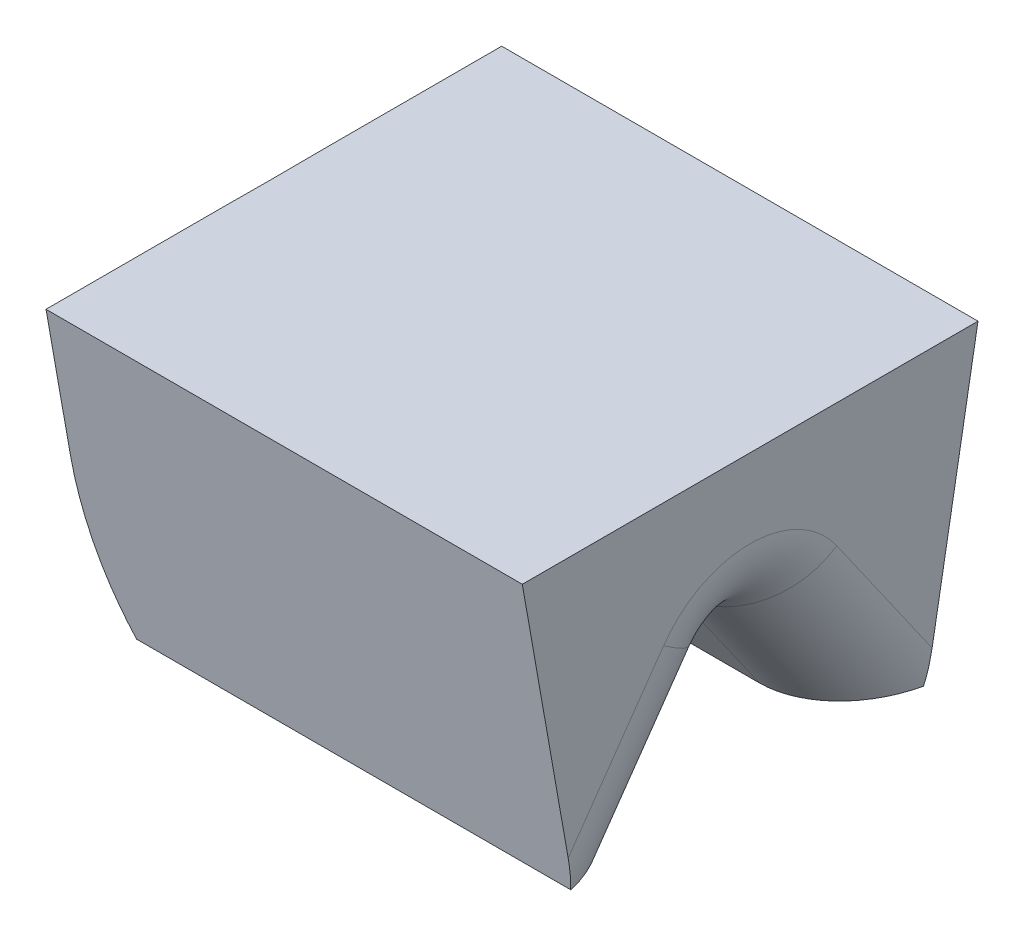
from build123d import *

# Parameters (mm, degrees)
SKETCH_TL_CUTTING_R    = 1.4986
TL_CUTTING_DEPTH       = 29.999999944
SKETCH_TDF_CUTTING_W   = 3.01719996
SKETCH_TDF_CUTTING_H   = 3.01719996
TDF_CUTTING_DEPTH      = 31.074766841
VW_VR_GRINDING_DEPTH   = 1.50859998
VW_VR_GRINDING_2_DEPTH = 1.50859998
ISA_GRINDING_DEPTH     = 1.50859998
SKETCH_PRE_FRX_BRX_W   = 1.15078002
SKETCH_PRE_FRX_BRX_H   = 0.89916
SKETCH_PRE_FRX_BRX_W_2 = 1.18077996
PRE_FRX_BRX_DEPTH      = 1.50859998
FA_BA_GRINDING_DEPTH   = 1.50859998
BR_EDM_R               = 0.24892
FR_EDM_R               = 0.12446


with BuildPart() as part:
    # sketch_TL_cutting → TL_cutting (new body)
    with BuildSketch(Plane(origin=(0, 0, 0), x_dir=(1, 0, 0), z_dir=(0, 1, 0))):
        with Locations(Location((0, 0, 0), (0, 0, 270))):
            Circle(SKETCH_TL_CUTTING_R)
    extrude(amount=TL_CUTTING_DEPTH)

    # sketch_TDF_cutting → TDF_cutting (cut, through all)
    with BuildSketch(Plane(origin=(0, 0, 0), x_dir=(1, 0, 0), z_dir=(0, 1, 0))):
        with Locations((-2.71001998, 0)):
            Rectangle(SKETCH_TDF_CUTTING_W, SKETCH_TDF_CUTTING_H)
    extrude(amount=TDF_CUTTING_DEPTH, mode=Mode.SUBTRACT)


with BuildPart() as body_2:
    # sketch_VW_VR_grinding → VW_VR_grinding (new, symmetric)
    with BuildSketch(Plane(origin=(0, 0, 0), x_dir=(0, 0, -1), z_dir=(1, 0, 0))):
        with BuildLine():
            Line((-1.49360001, -0.00999998), (-1.49360001, 0.888048914))
            ThreePointArc((-1.49360001, 0.888048914), (-1.493648337, 0.889155792), (-1.493792952, 0.890254246))
            Line((-1.493792952, 0.890254246), (-1.51859996, 1.030941782))
            Line((-1.51859996, 1.030941782), (-1.50859998, -0.00999998))
            Line((-1.50859998, -0.00999998), (-1.49360001, -0.00999998))
        make_face()
    extrude(amount=VW_VR_GRINDING_DEPTH, both=True)


with BuildPart() as body_3:
    # sketch_VW_VR_grinding → VW_VR_grinding 2 (new, symmetric)
    with BuildSketch(Plane(origin=(0, 0, 0), x_dir=(0, 0, -1), z_dir=(1, 0, 0))):
        with BuildLine():
            Line((1.49360001, -0.00999998), (1.49360001, 0.888048914))
            ThreePointArc((1.49360001, 0.888048914), (1.493648337, 0.889155792), (1.493792952, 0.890254246))
            Line((1.493792952, 0.890254246), (1.51859996, 1.030941782))
            Line((1.51859996, 1.030941782), (1.50859998, -0.00999998))
            Line((1.50859998, -0.00999998), (1.49360001, -0.00999998))
        make_face()
    extrude(amount=VW_VR_GRINDING_2_DEPTH, both=True)


    add(body_2.part)  # ISA_grinding merges body 2
    # sketch_ISA_grinding → ISA_grinding (add, symmetric)
    with BuildSketch(Plane(origin=(0, 0, 0), x_dir=(0, 0, -1), z_dir=(1, 0, 0))):
        Polygon((-0.25019, 0), (0.25019, 0), (1.50859998, 7.136797641), (1.50859998, -0.02999994), (-1.50859998, -0.02999994), (-1.50859998, 7.136797641), align=None)
    extrude(amount=ISA_GRINDING_DEPTH, both=True)

    # sketch_pre_FRX_BRX → pre_FRX_BRX (add, symmetric)
    with BuildSketch(Plane.XY):
        with Locations((0.92320999, 0.43958002)):
            Rectangle(SKETCH_PRE_FRX_BRX_W, SKETCH_PRE_FRX_BRX_H)
        with Locations((-0.92820998, 0.43958002)):
            Rectangle(SKETCH_PRE_FRX_BRX_W_2, SKETCH_PRE_FRX_BRX_H)
    extrude(amount=PRE_FRX_BRX_DEPTH, both=True)

    # sketch_FA_BA_grinding → FA_BA_grinding (add, symmetric)
    with BuildSketch(Plane.XY):
        Polygon((0.33782, -0.00999998), (0.33782, 0.89916), (1.6256, 10.062190821), (1.6256, -0.00999998), align=None)
        Polygon((-0.33782, -0.00999998), (-0.33782, 0.89916), (-1.32842, 7.947645247), (-1.32842, -0.00999998), align=None)
    extrude(amount=FA_BA_GRINDING_DEPTH, both=True)


with BuildPart() as part_1:
    add(part.part)

    # B1_fix: cut body 3
    add(body_3.part, mode=Mode.SUBTRACT)

    # V-Groove_EDM: sweep along a path in sketch_contour_V-Groove
    with BuildLine(Plane.XY) as v_groove_edm_path:
        Line((-1.20142, 0.1778), (1.4986, 0.1778))
    # sketch_section_V-Groove → V-Groove_EDM (sweep, cut)
    with BuildSketch(Plane(origin=(-1.20142, 0, -1.2954), x_dir=(0, 0, -1), z_dir=(1, 0, 0))):
        with BuildLine():
            Line((-1.274593538, 0.166968841), (-1.150678635, -0.00999998))
            Line((-1.150678635, -0.00999998), (-1.440121365, -0.00999998))
            Line((-1.440121365, -0.00999998), (-1.316206462, 0.166968841))
            ThreePointArc((-1.316206462, 0.166968841), (-1.2954, 0.1778), (-1.274593538, 0.166968841))
        make_face()
    sweep(path=v_groove_edm_path.line, mode=Mode.SUBTRACT)

    # BR_EDM
    br_edm_edges = [part_1.edges().sort_by_distance(p)[0] for p in [
        (-0.33782, 0.1778, 0),
        (-0.33782, 0.083484421, -0.079262883),
        (-0.33782, 0.083484421, 0.079262883),
    ]]
    fillet(br_edm_edges, radius=BR_EDM_R)

    # FR_EDM
    fr_edm_edges = [part_1.edges().sort_by_distance(p)[0] for p in [
        (0.33782, 0.083484421, -0.079262883),
        (0.33782, 0.083484421, 0.079262883),
        (0.33782, 0.1778, 0),
    ]]
    fillet(fr_edm_edges, radius=FR_EDM_R)

    # SurfaceCut1
    split(bisect_by=Plane(origin=(0, 0.41401793, 0), x_dir=(1, 0, 0), z_dir=(0, 1, 0)), keep=Keep.BOTTOM)


solid = part_1.part
